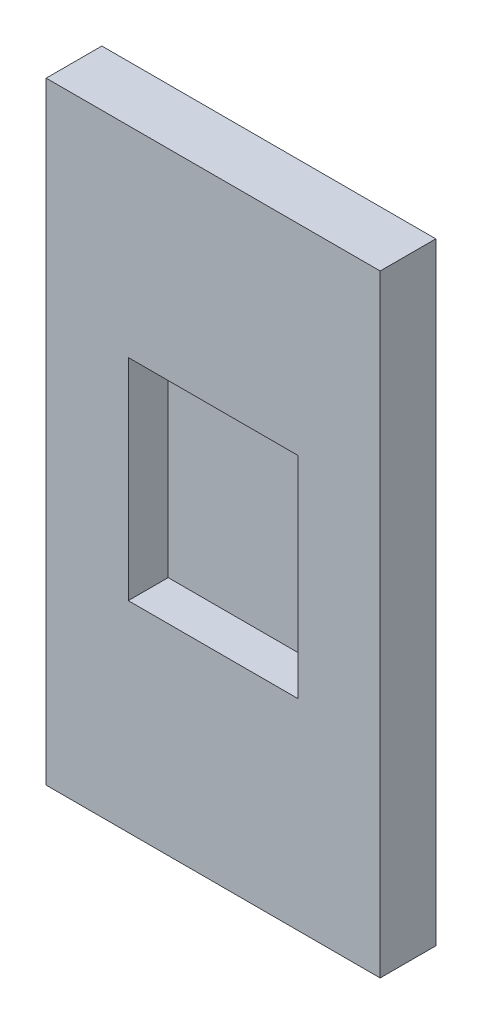
from build123d import *

# Parameters (mm, degrees)
SKETCH_1_W          = 18
SKETCH_1_H          = 33
EXTRUDE_1_DEPTH     = 3
SKETCH_2_W          = 9.15
SKETCH_2_H          = 11.35
CUT_EXTRUDE_1_DEPTH = 2.15


with BuildPart() as part:
    # 스케치1 → 보스-돌출1 (new body)
    with BuildSketch(Plane.XY):
        Rectangle(SKETCH_1_W, SKETCH_1_H)
    extrude(amount=EXTRUDE_1_DEPTH)

    # 스케치2 → 컷-돌출1 (cut)
    with BuildSketch(Plane.XY.offset(3)):
        Rectangle(SKETCH_2_W, SKETCH_2_H)
    extrude(amount=-CUT_EXTRUDE_1_DEPTH, mode=Mode.SUBTRACT)


solid = part.part
